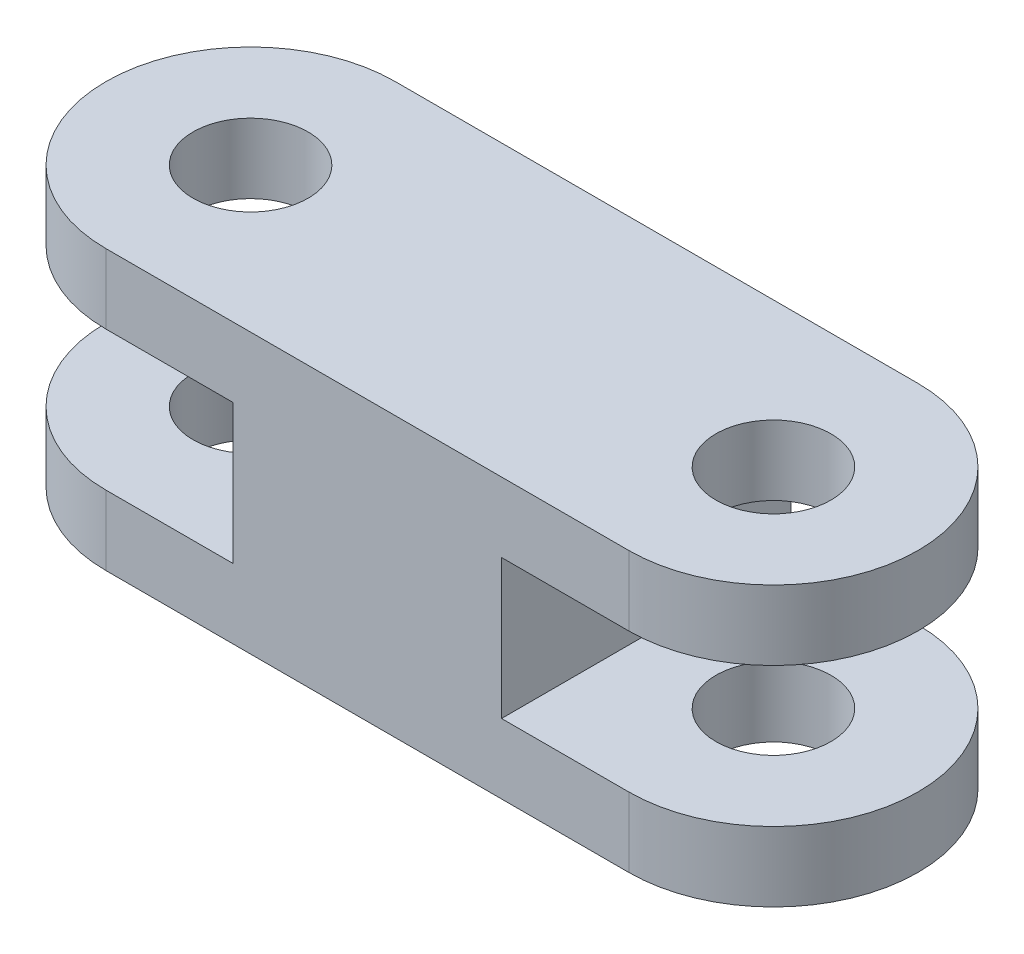
from build123d import *

# Parameters (mm, degrees)
SKETCH1_R           = 1.65
BOSS_EXTRUDE1_DEPTH = 2
SKETCH2_W           = 7.7
SKETCH2_H           = 8.3
BOSS_EXTRUDE2_DEPTH = 1


with BuildPart() as part:
    # Sketch1 → Boss-Extrude1 (new body)
    with BuildSketch(Plane(origin=(0, 0, 0), x_dir=(1, 0, 0), z_dir=(0, 1, 0))):
        with BuildLine():
            Line((-7.5, 4.15), (7.5, 4.15))
            ThreePointArc((7.5, 4.15), (11.65, 0), (7.5, -4.15))
            Line((7.5, -4.15), (-7.5, -4.15))
            ThreePointArc((-7.5, -4.15), (-11.65, 0), (-7.5, 4.15))
        make_face()
        with Locations(Location((-7.5, 0, 0), (0, 0, 270))):
            Circle(SKETCH1_R, mode=Mode.SUBTRACT)
        with Locations(Location((7.5, 0, 0), (0, 0, 270))):
            Circle(SKETCH1_R, mode=Mode.SUBTRACT)
    extrude(amount=BOSS_EXTRUDE1_DEPTH)

    # Sketch2 → Boss-Extrude2 (add)
    with BuildSketch(Plane(origin=(0, 2, 0), x_dir=(1, 0, 0), z_dir=(0, 1, 0))):
        Rectangle(SKETCH2_W, SKETCH2_H)
    boss_extrude2 = extrude(amount=BOSS_EXTRUDE2_DEPTH)

    # Mirror1: Boss-Extrude2 across plane
    add(boss_extrude2.mirror(Plane.ZX.offset(3)))

    # Mirror4: part across plane


with BuildPart() as part_1:
    add(part.part)
    add(part.part.mirror(Plane(origin=(0, 4, 0), x_dir=(0, 0, 1), z_dir=(0, -1, 0))))


solid = part_1.part
